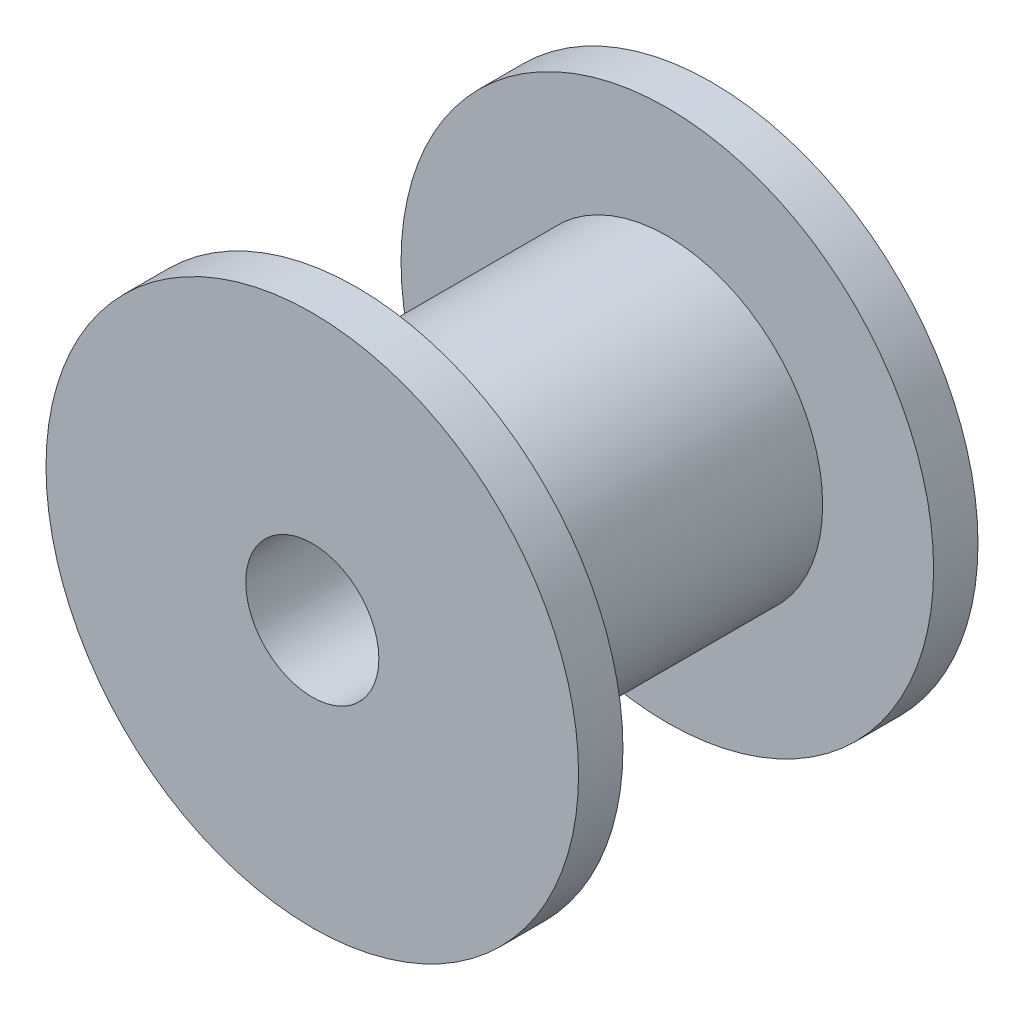
from build123d import *

# Parameters (mm, degrees)
SKETCH2_R               = 6
SKETCH2_R_2             = 1.5
BOSS_EXTRUDE1_DEPTH     = 9
CUT_EXTRUDE_THIN1_START = 1
SKETCH2_3_R             = 13.5
SKETCH2_3_R_2           = 3.5
CUT_EXTRUDE_THIN1_DEPTH = 7


with BuildPart() as part:
    # Sketch2 → Boss-Extrude1 (new body)
    with BuildSketch(Plane.XY):
        Circle(SKETCH2_R)
        Circle(SKETCH2_R_2, mode=Mode.SUBTRACT)
    extrude(amount=BOSS_EXTRUDE1_DEPTH)

    # Sketch2<3> → Cut-Extrude-Thin1 (cut)
    with BuildSketch(Plane.XY.offset(CUT_EXTRUDE_THIN1_START)):
        Circle(SKETCH2_3_R)
        Circle(SKETCH2_3_R_2, mode=Mode.SUBTRACT)
    extrude(amount=CUT_EXTRUDE_THIN1_DEPTH, mode=Mode.SUBTRACT)


solid = part.part
